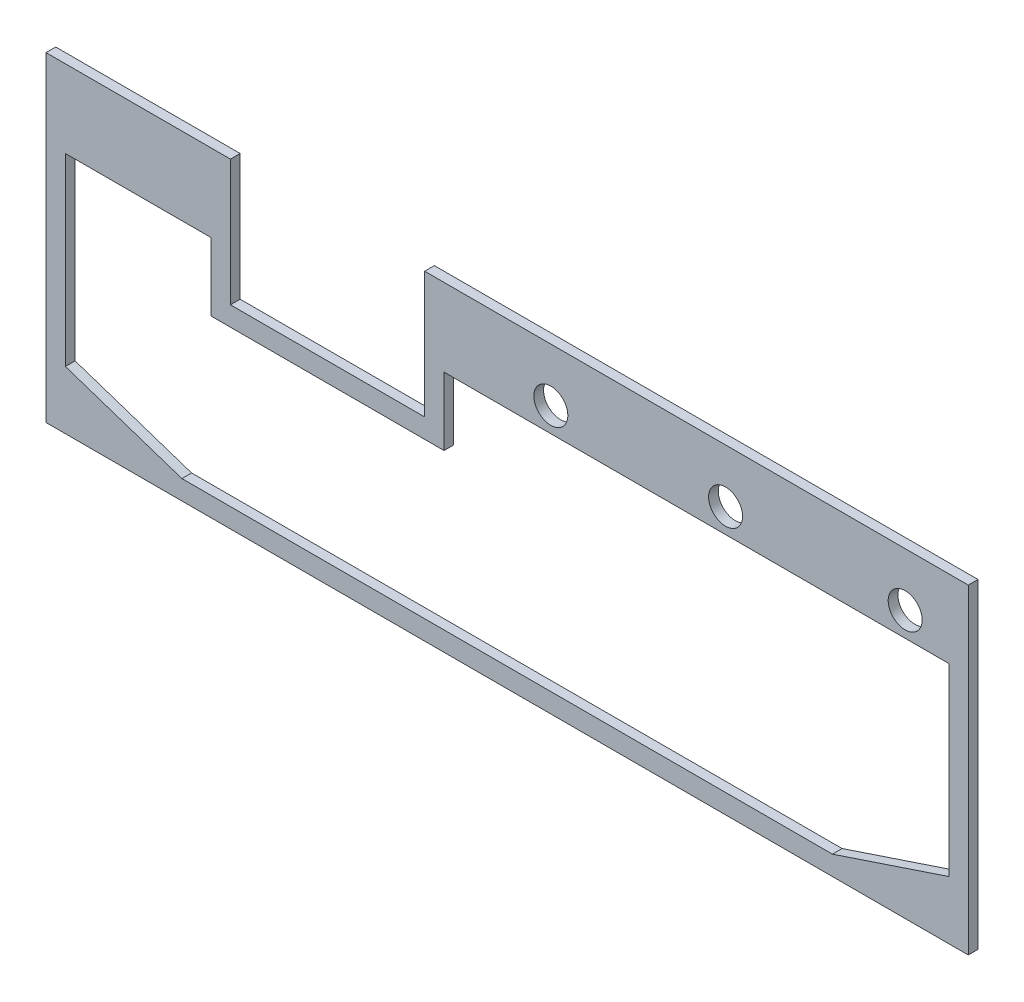
from build123d import *

# Parameters (mm, degrees)
BOSS_EXTRUDE2_DEPTH   = 1
CUT_EXTRUDE2_DEPTH    = 1
F_3_0MM_DOWEL_HOLE1_D = 3.5


with BuildPart() as part:
    # Sketch2 → Boss-Extrude2 (new body)
    with BuildSketch(Plane.XY):
        Polygon((2, 8), (2, -25), (-93, -25), (-93, 8), (-74, 8), (-74, -5), (-54, -5), (-54, 8), align=None)
    extrude(amount=BOSS_EXTRUDE2_DEPTH)

    # Sketch1 → Cut-Extrude2 (cut)
    with BuildSketch(Plane.XY):
        Polygon((0, 0), (0, -19), (-12, -23), (-79, -23), (-91, -19), (-91, 0), (-76, 0), (-76, -7), (-52, -7), (-52, 0), align=None)
    extrude(amount=CUT_EXTRUDE2_DEPTH, mode=Mode.SUBTRACT)

    # Ø3.0mm Dowel Hole1 (through all)
    with Locations(Plane.XY.offset(1)):
        with Locations((-41, 2.5), (-23, 2.5), (-4.5, 2.5)):
            Hole(F_3_0MM_DOWEL_HOLE1_D / 2)


solid = part.part
